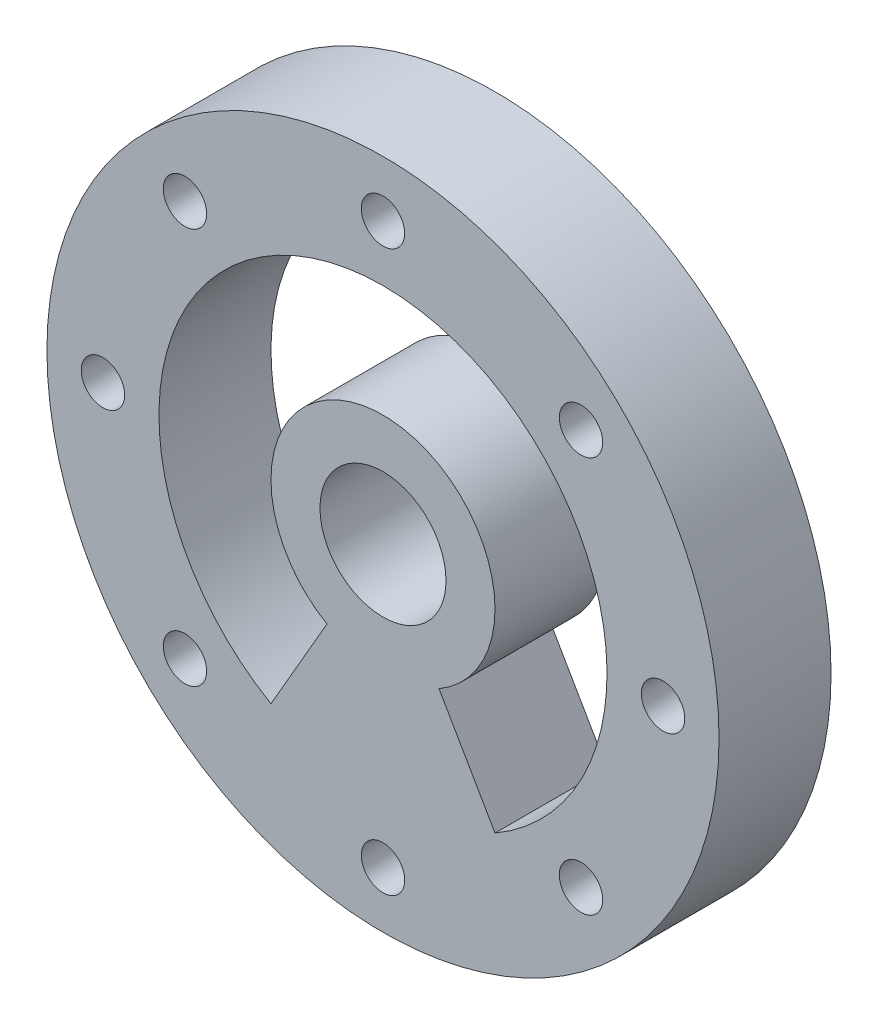
from build123d import *

# Parameters (mm, degrees)
SKETCH6_R           = 24
BOSS_EXTRUDE1_DEPTH = 8
CUT_EXTRUDE4_DEPTH  = 8
SKETCH7_R           = 4.5
CUT_EXTRUDE5_DEPTH  = 8
SKETCH8_R           = 1.55
CUT_EXTRUDE6_DEPTH  = 8


with BuildPart() as part:
    # Sketch6 → Boss-Extrude1 (new body)
    with BuildSketch(Plane.XY):
        Circle(SKETCH6_R)
    extrude(amount=BOSS_EXTRUDE1_DEPTH)

    # Sketch4 → Cut-Extrude4 (cut)
    with BuildSketch(Plane.XY):
        with BuildLine():
            Line((-4, -6.92820323), (-8, -13.856406461))
            ThreePointArc((-8, -13.856406461), (0, 16), (8, -13.856406461))
            Line((8, -13.856406461), (4, -6.92820323))
            ThreePointArc((4, -6.92820323), (0, 8), (-4, -6.92820323))
        make_face()
    extrude(amount=CUT_EXTRUDE4_DEPTH, mode=Mode.SUBTRACT)

    # Sketch7 → Cut-Extrude5 (cut)
    with BuildSketch(Plane(origin=(0, 0, 0), x_dir=(-1, 0, 0), z_dir=(0, 0, -1))):
        Circle(SKETCH7_R)
    extrude(amount=-CUT_EXTRUDE5_DEPTH, mode=Mode.SUBTRACT)

    # Sketch8 → Cut-Extrude6 (cut)
    with BuildSketch(Plane(origin=(0, 0, 8), x_dir=(-1, 0, 0), z_dir=(0, 0, -1))):
        with Locations(Location((0, 20, 0), (0, 0, 180))):
            Circle(SKETCH8_R)
        with Locations(Location((14.142135624, 14.142135624, 0), (0, 0, 180))):
            Circle(SKETCH8_R)
        with Locations(Location((20, 0, 0), (0, 0, 180))):
            Circle(SKETCH8_R)
        with Locations(Location((14.142135624, -14.142135624, 0), (0, 0, 180))):
            Circle(SKETCH8_R)
        with Locations(Location((0, -20, 0), (0, 0, 180))):
            Circle(SKETCH8_R)
        with Locations(Location((-14.142135624, -14.142135624, 0), (0, 0, 180))):
            Circle(SKETCH8_R)
        with Locations(Location((-20, 0, 0), (0, 0, 180))):
            Circle(SKETCH8_R)
        with Locations(Location((-14.142135624, 14.142135624, 0), (0, 0, 180))):
            Circle(SKETCH8_R)
    extrude(amount=CUT_EXTRUDE6_DEPTH, mode=Mode.SUBTRACT)


solid = part.part
